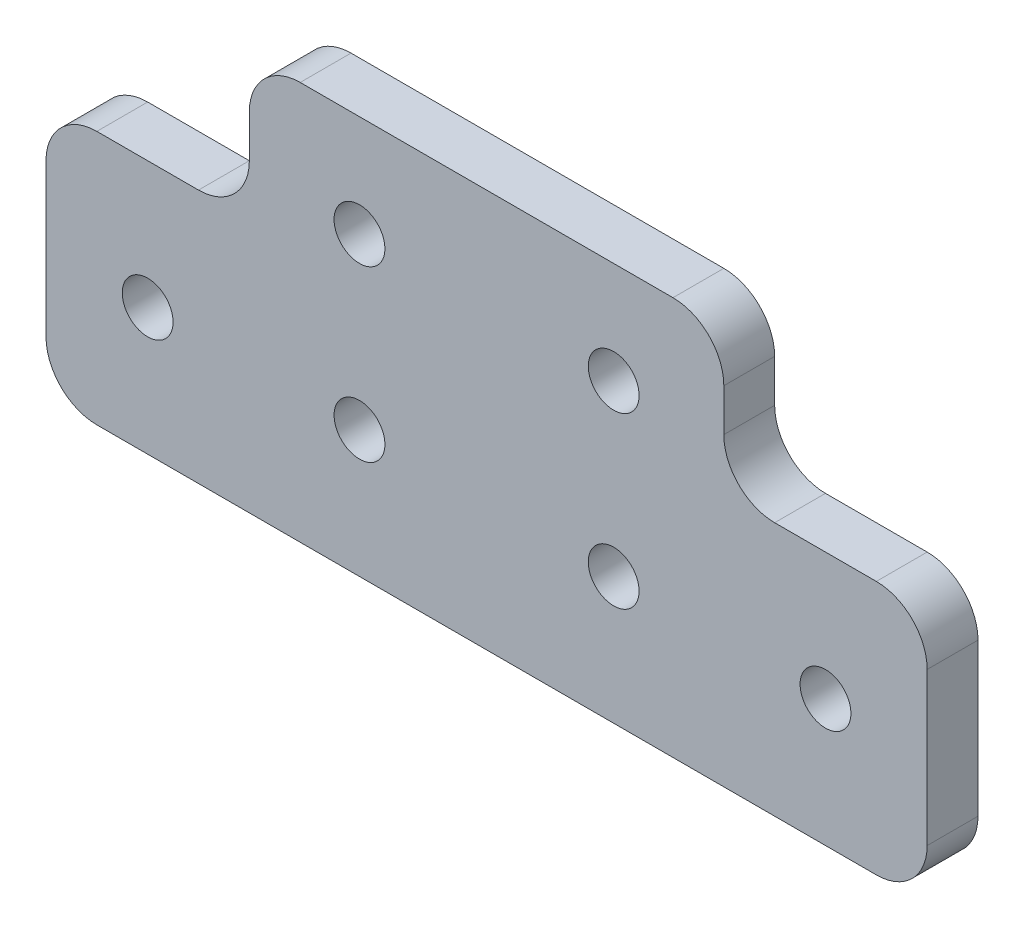
from build123d import *

# Parameters (mm, degrees)
SKETCH_1_W      = 28
SKETCH_1_H      = 22
SKETCH_1_R      = 1.5
EXTRUDE_1_DEPTH = 3
EXTRUDE_START   = -3
SKETCH_2_W      = 52
SKETCH_2_H      = 15
SKETCH_2_R      = 1.5
EXTRUDE_3_DEPTH = 3
FILLET_1_R      = 3


with BuildPart() as part:
    # 草图1 → 凸台-拉伸1 (new body)
    with BuildSketch(Plane.XY):
        Rectangle(SKETCH_1_W, SKETCH_1_H)
        with Locations((7.5, 5)):
            Circle(SKETCH_1_R, mode=Mode.SUBTRACT)
        with Locations(Location((7.5, -5, 0), (0, 0, 180))):
            Circle(SKETCH_1_R, mode=Mode.SUBTRACT)
        with Locations((-7.5, -5)):
            Circle(SKETCH_1_R, mode=Mode.SUBTRACT)
        with Locations(Location((-7.5, 5, 0), (0, 0, 180))):
            Circle(SKETCH_1_R, mode=Mode.SUBTRACT)
    extrude(amount=EXTRUDE_1_DEPTH)

    # 草图2 → 凸台-拉伸3 (add)
    with BuildSketch(Plane.XY.offset(3).offset(EXTRUDE_START)):
        with Locations((0, -5)):
            Rectangle(SKETCH_2_W, SKETCH_2_H)
        with Locations((20, -5)):
            Circle(SKETCH_2_R, mode=Mode.SUBTRACT)
        with Locations(Location((-20, -5, 0), (0, 0, 180))):
            Circle(SKETCH_2_R, mode=Mode.SUBTRACT)
        with Locations((-7.5, -5)):
            Circle(SKETCH_2_R, mode=Mode.SUBTRACT)
        with Locations(Location((7.5, -5, 0), (0, 0, 180))):
            Circle(SKETCH_2_R, mode=Mode.SUBTRACT)
    extrude(amount=EXTRUDE_3_DEPTH)

    # 圆角1
    fillet_1_edges = [part.edges().sort_by_distance(p)[0] for p in [
        (-14, 2.5, 1.5),
        (-26, 2.5, 1.5),
        (26, 2.5, 1.5),
        (26, -12.5, 1.5),
        (-26, -12.5, 1.5),
        (14, 2.5, 1.5),
        (-14, 11, 1.5),
        (14, 11, 1.5),
    ]]
    fillet(fillet_1_edges, radius=FILLET_1_R)


solid = part.part
